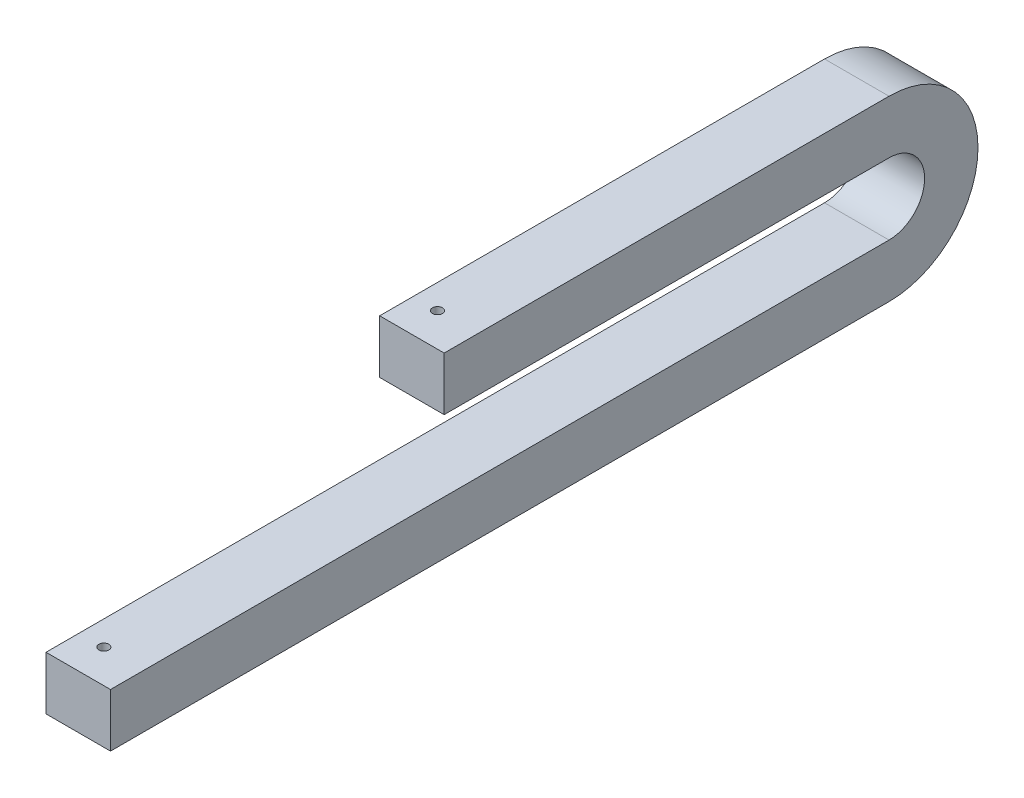
from build123d import *

# Parameters (mm, degrees)
EXTRUDE_1_DEPTH     = 29
SKETCH_2_R          = 2.25
CUT_EXTRUDE_1_DEPTH = 90
SKETCH_3_R          = 2.25
CUT_EXTRUDE_2_DEPTH = 40


with BuildPart() as part:
    # 草图1 → 凸台-拉伸1 (new body)
    with BuildSketch(Plane(origin=(0, 0, 0), x_dir=(0, 0, -1), z_dir=(1, 0, 0))):
        with BuildLine():
            Line((0, 0), (350, 0))
            ThreePointArc((350, 0), (366, 16), (350, 32))
            Line((350, 32), (150, 32))
            Line((150, 32), (150, 56))
            Line((150, 56), (350, 56))
            ThreePointArc((350, 56), (390, 16), (350, -24))
            Line((350, -24), (0, -24))
            Line((0, -24), (0, 0))
        make_face()
    extrude(amount=EXTRUDE_1_DEPTH)

    # 草图2 → 切除-拉伸1 (cut)
    with BuildSketch(Plane(origin=(0, 0, 0), x_dir=(1, 0, 0), z_dir=(0, 1, 0))):
        with Locations((36, 15)):
            Circle(SKETCH_2_R)
        with Locations(Location((11, 15, 0), (0, 0, 270))):
            Circle(SKETCH_2_R)
    extrude(amount=-CUT_EXTRUDE_1_DEPTH, mode=Mode.SUBTRACT)

    # 草图3 → 切除-拉伸2 (cut)
    with BuildSketch(Plane(origin=(0, 56, 0), x_dir=(1, 0, 0), z_dir=(0, 1, 0))):
        with Locations(Location((11, 165, 0), (0, 0, 270))):
            Circle(SKETCH_3_R)
        with Locations((36, 165)):
            Circle(SKETCH_3_R)
    extrude(amount=-CUT_EXTRUDE_2_DEPTH, mode=Mode.SUBTRACT)


solid = part.part
